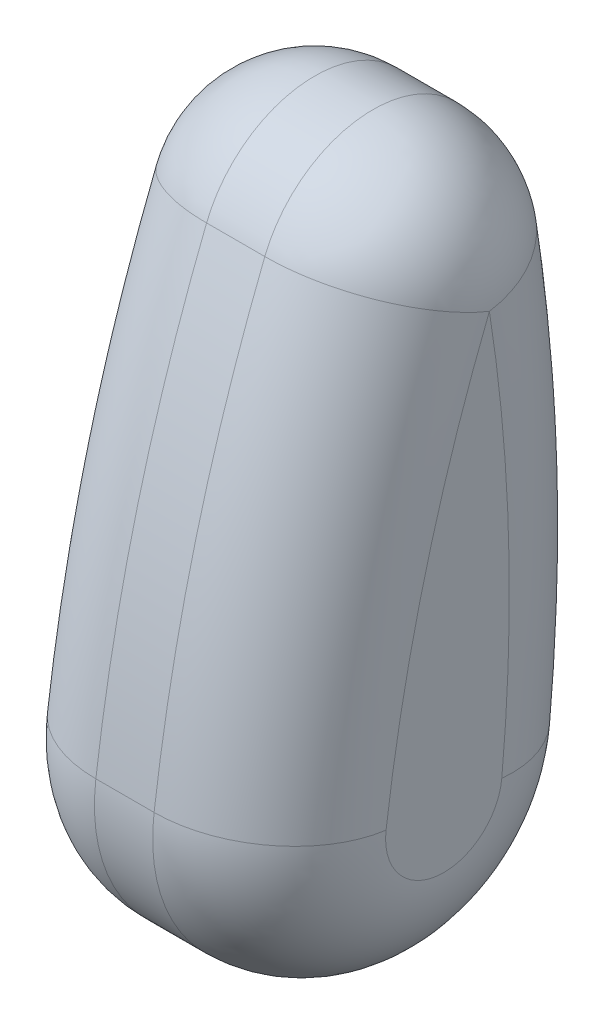
from build123d import *

# Parameters (mm, degrees)
BASE_EXTRUDE_DEPTH = 63.5
FILLET1_R          = 50.8


with BuildPart() as part:
    # Sketch8 → Base-Extrude (new, symmetric)
    with BuildSketch(Plane(origin=(0, 0, 0), x_dir=(0, 0, -1), z_dir=(1, 0, 0))):
        with BuildLine():
            ThreePointArc((-69.637611743, 202.48222577), (-2.581676341, 117.03801616), (81.787388717, 185.441760865))
            ThreePointArc((81.787388717, 185.441760865), (84.963831694, 281.584095527), (76.002168347, 377.360537798))
            ThreePointArc((76.002168347, 377.360537798), (31.50354767, 419.926176219), (-21.342474806, 388.31512238))
            ThreePointArc((-21.342474806, 388.31512238), (-51.366642463, 296.925912619), (-69.637611743, 202.48222577))
        make_face()
    extrude(amount=BASE_EXTRUDE_DEPTH, both=True)

    # Fillet1
    fillet1_edges = [part.edges().sort_by_distance(p)[0] for p in [
        (-63.5, 117.03801616, 2.581676341),
        (63.5, 117.03801616, 2.581676341),
        (-63.5, 296.925912619, 51.366642463),
        (63.5, 296.925912619, 51.366642463),
        (-63.5, 419.926176219, -31.50354767),
        (63.5, 419.926176219, -31.50354767),
        (63.5, 281.584095527, -84.963831694),
        (-63.5, 281.584095527, -84.963831694),
    ]]
    fillet(fillet1_edges, radius=FILLET1_R)


solid = part.part
